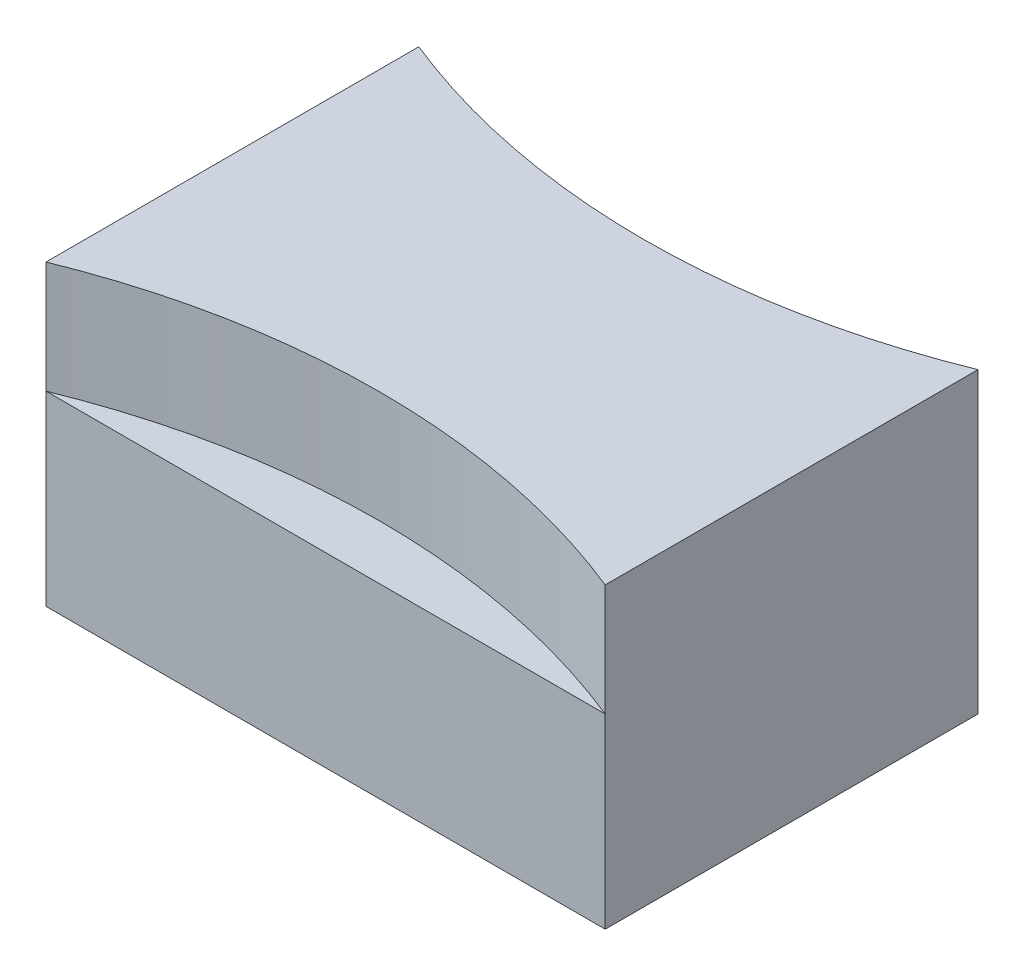
from build123d import *

# Parameters (mm, degrees)
CROQUIS1_W              = 15
CROQUIS1_H              = 10
SALIENTE_EXTRUIR1_DEPTH = 8
CORTAR_EXTRUIR1_DEPTH   = 3


with BuildPart() as part:
    # Croquis1 → Saliente-Extruir1 (new body)
    with BuildSketch(Plane(origin=(0, 0, 0), x_dir=(1, 0, 0), z_dir=(0, 1, 0))):
        Rectangle(CROQUIS1_W, CROQUIS1_H)
    extrude(amount=SALIENTE_EXTRUIR1_DEPTH)

    # Croquis2 → Cortar-Extruir1 (cut)
    with BuildSketch(Plane(origin=(0, 8, 0), x_dir=(-1, 0, 0), z_dir=(0, 1, 0))):
        with BuildLine():
            Line((-7.5, -5), (7.5, -5))
            ThreePointArc((7.5, -5), (0, -3.540496218), (-7.5, -5))
        make_face()
        with BuildLine():
            ThreePointArc((-7.5, 5), (0, 3.540496218), (7.5, 5))
            Line((7.5, 5), (-7.5, 5))
        make_face()
    extrude(amount=-CORTAR_EXTRUIR1_DEPTH, mode=Mode.SUBTRACT)


solid = part.part
